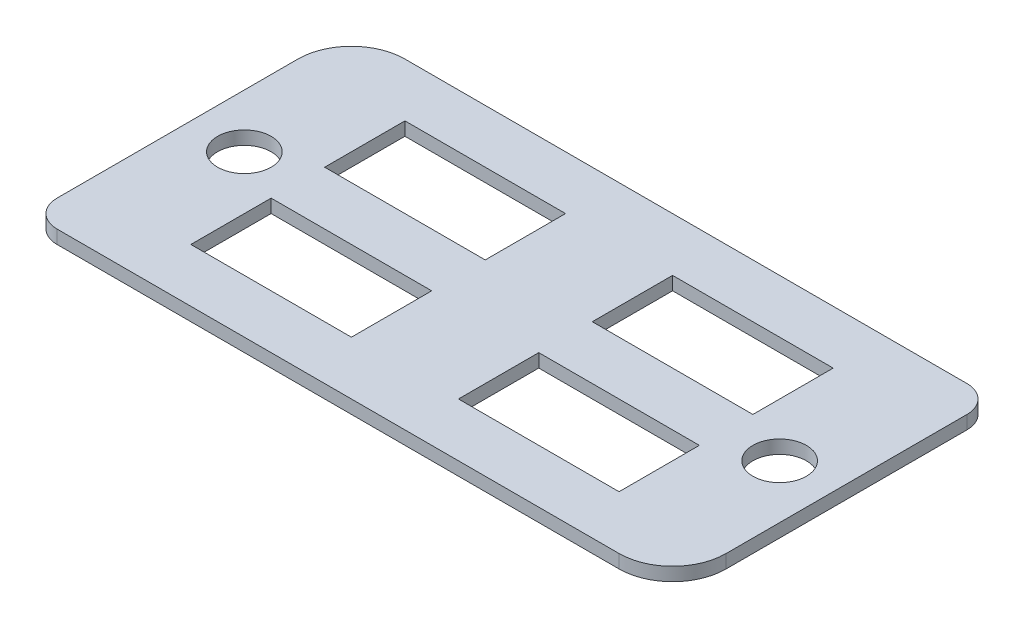
from build123d import *

# Parameters (mm, degrees)
SKETCH1_W           = 304.8
SKETCH1_H           = 152.4
SKETCH1_R           = 12.7
SKETCH1_W_2         = 76.2
SKETCH1_H_2         = 38.1
BOSS_EXTRUDE1_DEPTH = 6.35
FILLET2_R           = 25.4
FILLET3_R           = 12.7


with BuildPart() as part:
    # Sketch1 → Boss-Extrude1 (new body)
    with BuildSketch(Plane(origin=(0, 0, 0), x_dir=(1, 0, 0), z_dir=(0, 1, 0))):
        with Locations((152.4, 76.2)):
            Rectangle(SKETCH1_W, SKETCH1_H)
        with Locations(Location((25.4, 76.2, 0), (0, 0, 270))):
            Circle(SKETCH1_R, mode=Mode.SUBTRACT)
        with Locations(Location((279.4, 76.2, 0), (0, 0, 270))):
            Circle(SKETCH1_R, mode=Mode.SUBTRACT)
        with Locations((88.9, 107.95)):
            Rectangle(SKETCH1_W_2, SKETCH1_H_2, mode=Mode.SUBTRACT)
        with Locations((88.9, 44.45)):
            Rectangle(SKETCH1_W_2, SKETCH1_H_2, mode=Mode.SUBTRACT)
        with Locations((215.9, 107.95)):
            Rectangle(SKETCH1_W_2, SKETCH1_H_2, mode=Mode.SUBTRACT)
        with Locations((215.9, 44.45)):
            Rectangle(SKETCH1_W_2, SKETCH1_H_2, mode=Mode.SUBTRACT)
    extrude(amount=BOSS_EXTRUDE1_DEPTH)

    # Fillet2
    fillet2_edges = [part.edges().sort_by_distance(p)[0] for p in [
        (0, 3.175, -152.4),
        (304.8, 3.175, 0),
    ]]
    fillet(fillet2_edges, radius=FILLET2_R)

    # Fillet3
    fillet3_edges = [part.edges().sort_by_distance(p)[0] for p in [
        (304.8, 3.175, -152.4),
        (0, 3.175, 0),
    ]]
    fillet(fillet3_edges, radius=FILLET3_R)


solid = part.part
